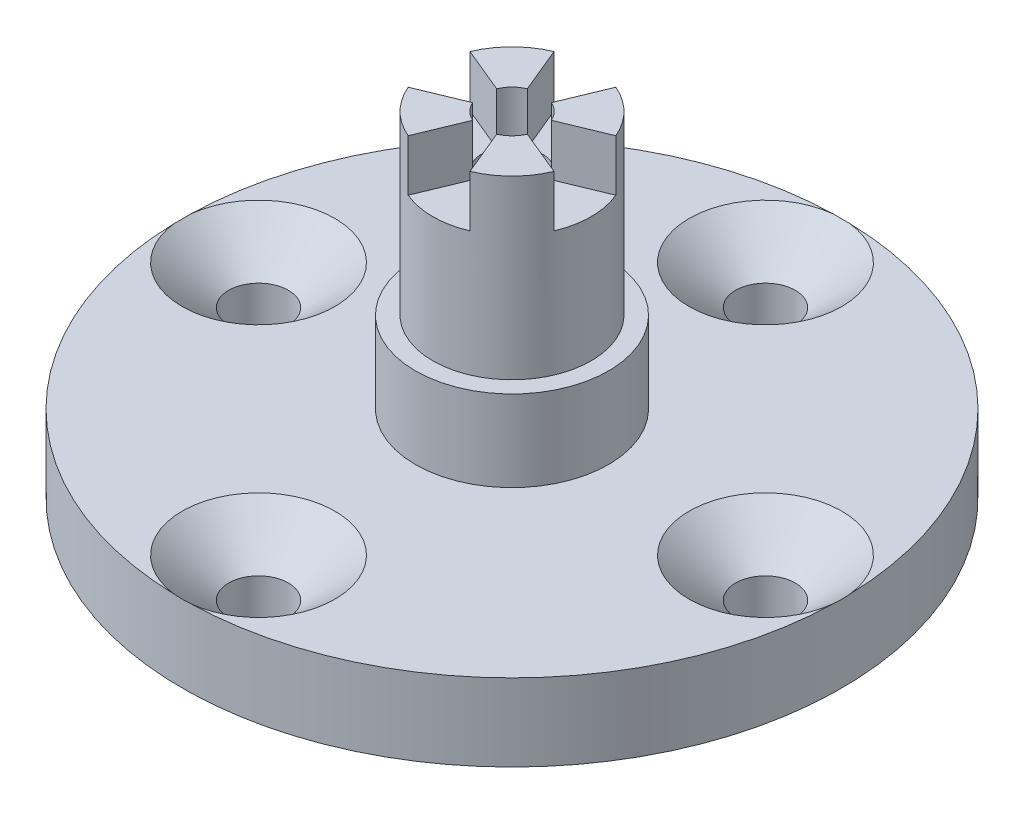
from build123d import *
from build123d.topology import SkipClean

# Parameters (mm, degrees)
SKETCH1_R                                         = 4.7625
BOSS_EXTRUDE1_DEPTH                               = 10.16
SKETCH3_R                                         = 16.25
BOSS_EXTRUDE2_DEPTH                               = 3.81
F_4_CLEARANCE_HOLE1_D                             = 2.9464
CUT_EXTRUDE1_START                                = -6.1595
SKETCH6_R                                         = 4.7625
SKETCH6_R_2                                       = 3.90525
CUT_EXTRUDE1_DEPTH                                = 6.1595
CUT_EXTRUDE4_DEPTH                                = 6.35
BOSS_EXTRUDE3_DEPTH                               = 2.54
CIRPATTERN1_COUNT                                 = 4
CSK_FOR_4_FLAT_HEAD_MACHINE_SCREW_100_D           = 2.9464
CSK_FOR_4_FLAT_HEAD_MACHINE_SCREW_100_CSINK_D     = 7.531227
CSK_FOR_4_FLAT_HEAD_MACHINE_SCREW_100_CSINK_ANGLE = 100
CIRPATTERN2_COUNT                                 = 4


with BuildPart() as part:
    # Sketch1 → Boss-Extrude1 (new body)
    with BuildSketch(Plane(origin=(0, 0, 0), x_dir=(1, 0, 0), z_dir=(0, 1, 0))):
        with Locations(Location((0, 0, 0), (0, 0, 270))):
            Circle(SKETCH1_R)
    extrude(amount=BOSS_EXTRUDE1_DEPTH)

    # Sketch3 → Boss-Extrude2 (add)
    with BuildSketch(Plane.XZ):
        with Locations(Location((0, 0, 0), (0, 0, 90))):
            Circle(SKETCH3_R)
    extrude(amount=BOSS_EXTRUDE2_DEPTH)

    # #4 Clearance Hole1 (through all)
    with Locations(Plane(origin=(0, -3.81, 0), x_dir=(-1, 0, 0), z_dir=(0, -1, 0))):
        with Locations((0, 0)):
            Hole(F_4_CLEARANCE_HOLE1_D / 2)

    # Sketch6 → Cut-Extrude1 (cut)
    with BuildSketch(Plane(origin=(0, 10.16, 0), x_dir=(1, 0, 0), z_dir=(0, 1, 0)).offset(CUT_EXTRUDE1_START)):
        with Locations(Location((0, 0, 0), (0, 0, 270))):
            Circle(SKETCH6_R)
        with Locations(Location((0, 0, 0), (0, 0, 270))):
            Circle(SKETCH6_R_2, mode=Mode.SUBTRACT)
    extrude(amount=CUT_EXTRUDE1_DEPTH, mode=Mode.SUBTRACT)

    # Sketch7 → Cut-Extrude4 (cut)
    with BuildSketch(Plane.XZ.offset(3.81)):
        Polygon((-3.666174209, 0), (-1.833087105, -3.175), (1.833087105, -3.175), (3.666174209, 0), (1.833087105, 3.175), (-1.833087105, 3.175), align=None)
    extrude(amount=-CUT_EXTRUDE4_DEPTH, mode=Mode.SUBTRACT)

    # Sketch8 → Boss-Extrude3 (add)
    with BuildSketch(Plane(origin=(0, 10.16, 0), x_dir=(1, 0, 0), z_dir=(0, 1, 0))):
        with BuildLine():
            Line((-0.592971464, 1.348593001), (-1.523758258, 3.595711103))
            ThreePointArc((-1.523758258, 3.595711103), (-2.761428757, 2.761428757), (-3.595711103, 1.523758258))
            Line((-3.595711103, 1.523758258), (-1.348593001, 0.592971464))
            ThreePointArc((-1.348593001, 0.592971464), (-1.04170971, 1.04170971), (-0.592971464, 1.348593001))
        make_face()
    boss_extrude3 = extrude(amount=BOSS_EXTRUDE3_DEPTH)

    # CirPattern1: Boss-Extrude3 ×4 about axis
    with SkipClean():  # the faces are left unmerged after this step: merging them gives an invalid solid
        cirpattern1_axis = Axis((0, 0, 0), (0, 1, 0))
        for i in range(1, CIRPATTERN1_COUNT):
            add(boss_extrude3.rotate(cirpattern1_axis, i * 360 / CIRPATTERN1_COUNT))

    # CSK for #4 Flat Head Machine Screw (100)1 (through all)
    with Locations(Plane(origin=(0, 0, 0), x_dir=(1, 0, 0), z_dir=(0, 1, 0))):
        with Locations((0, 12.5)):
            csk_for_4_flat_head_machine_screw_100 = CounterSinkHole(CSK_FOR_4_FLAT_HEAD_MACHINE_SCREW_100_D / 2, CSK_FOR_4_FLAT_HEAD_MACHINE_SCREW_100_CSINK_D / 2, counter_sink_angle=CSK_FOR_4_FLAT_HEAD_MACHINE_SCREW_100_CSINK_ANGLE)

    # CirPattern2: CSK for #4 Flat Head Machine Screw (100)1 ×4 about axis
    with SkipClean():  # the faces are left unmerged after this step: merging them gives an invalid solid
        cirpattern2_axis = Axis((0, 0, 0), (0, 1, 0))
        for i in range(1, CIRPATTERN2_COUNT):
            add(csk_for_4_flat_head_machine_screw_100.rotate(cirpattern2_axis, i * 360 / CIRPATTERN2_COUNT), mode=Mode.SUBTRACT)


solid = part.part
